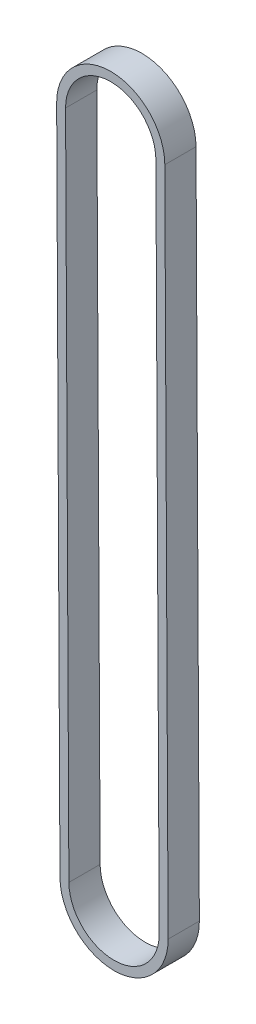
from build123d import *

# Parameters (mm, degrees)
EXTRUDE_1_DEPTH = 3.5


with BuildPart() as part:
    # 草图2 → 拉伸-薄壁1 (new, symmetric)
    with BuildSketch(Plane.XY):
        with BuildLine():
            Line((11.380055252, 150.058355207), (12.124850533, 0.060204285))
            ThreePointArc((12.124850533, 0.060204285), (0.060204285, -12.124850533), (-12.124850533, -0.060204285))
            Line((-12.124850533, -0.060204285), (-12.869645814, 149.937946637))
            ThreePointArc((-12.869645814, 149.937946637), (-0.804999566, 162.123001455), (11.380055252, 150.058355207))
        make_face()
        with BuildLine():
            Line((9.380079907, 150.048424603), (10.124875187, 0.050273681))
            ThreePointArc((10.124875187, 0.050273681), (0.050273681, -10.124875187), (-10.124875187, -0.050273681))
            Line((-10.124875187, -0.050273681), (-10.869670468, 149.94787724))
            ThreePointArc((-10.869670468, 149.94787724), (-0.795068962, 160.123026109), (9.380079907, 150.048424603))
        make_face(mode=Mode.SUBTRACT)
    extrude(amount=EXTRUDE_1_DEPTH, both=True)


solid = part.part
